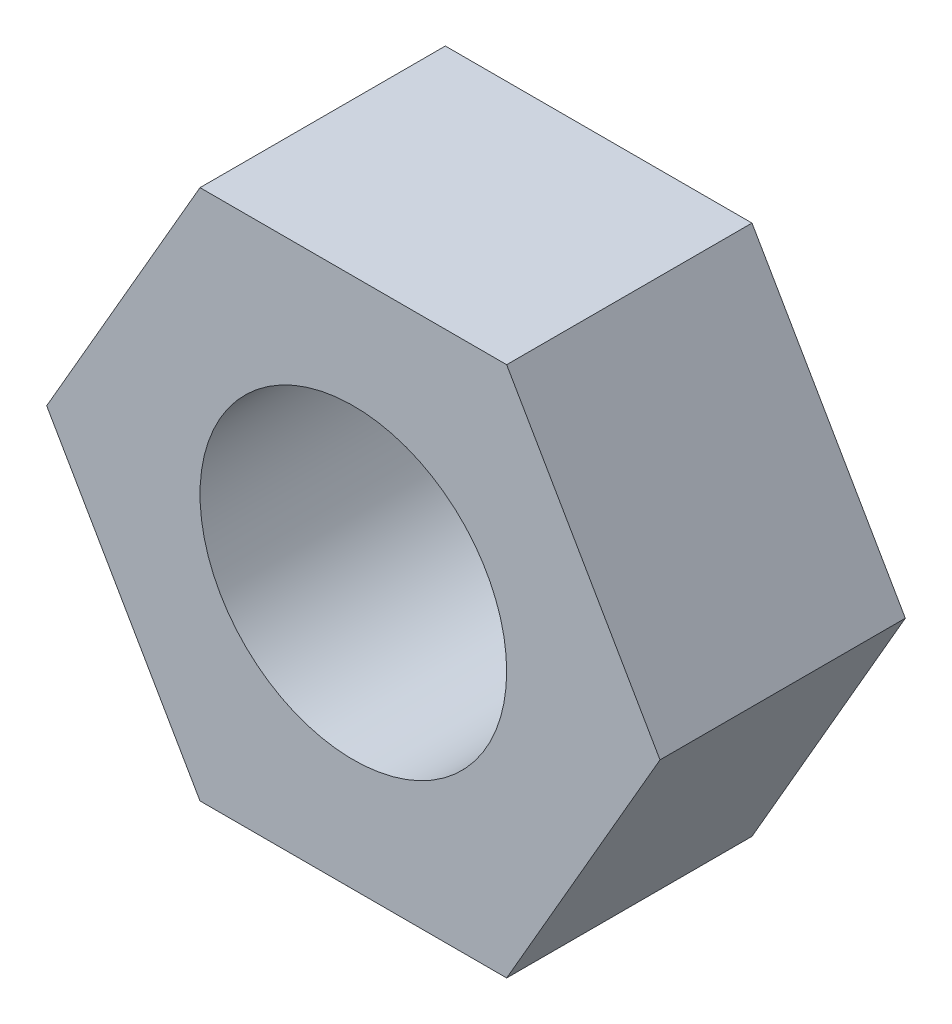
from build123d import *

# Parameters (mm, degrees)
BOSS_EXTRUDE1_DEPTH = 4
SKETCH2_R           = 2.5
CUT_EXTRUDE1_DEPTH  = 8.729812417


with BuildPart() as part:
    # Sketch1 → Boss-Extrude1 (new body)
    with BuildSketch(Plane.XY):
        Polygon((5, 0), (2.5, 4.330127019), (-2.5, 4.330127019), (-5, 0), (-2.5, -4.330127019), (2.5, -4.330127019), align=None)
    extrude(amount=BOSS_EXTRUDE1_DEPTH)

    # Sketch2 → Cut-Extrude1 (cut, through all)
    with BuildSketch(Plane.XY.offset(4)):
        Circle(SKETCH2_R)
    extrude(amount=-CUT_EXTRUDE1_DEPTH, mode=Mode.SUBTRACT)


solid = part.part
